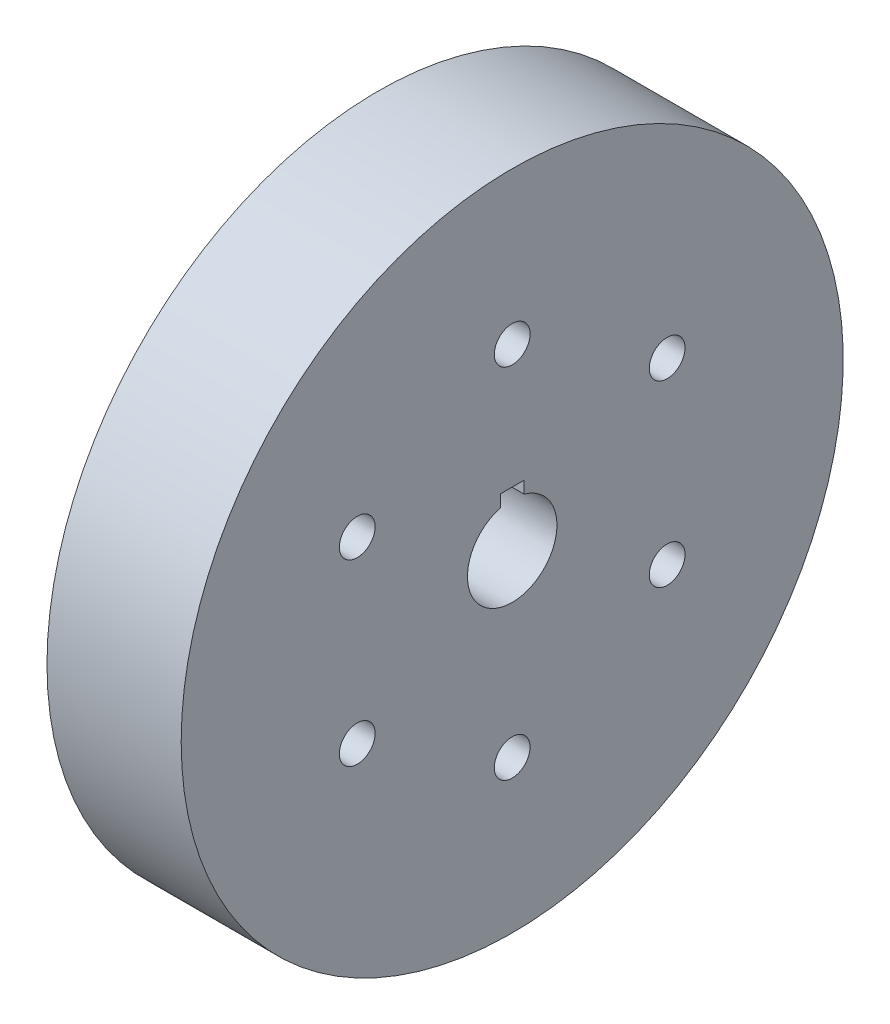
from build123d import *

# Parameters (mm, degrees)
SKETCH5_W          = 8
SKETCH5_H          = 7
CUT_EXTRUDE5_DEPTH = 172.877863613
SKETCH12_R         = 6
CUT_EXTRUDE6_DEPTH = 161.832210704


with BuildPart() as part:
    # Sketch2 → Revolve3 (revolve)
    with BuildSketch(Plane(origin=(0, 0, 0), x_dir=(1, 0, 0), z_dir=(0, 1, 0)), mode=Mode.PRIVATE) as revolve3_sk:
        with BuildLine():
            Line((0, 15), (0, 111))
            Line((0, 111), (-45, 111))
            Line((-45, 111), (-45, 96))
            Line((-45, 96), (-40, 96))
            ThreePointArc((-40, 96), (-36.464466094, 94.535533906), (-35, 91))
            Line((-35, 91), (-35, 35))
            ThreePointArc((-35, 35), (-36.464466094, 31.464466094), (-40, 30))
            Line((-40, 30), (-70, 30))
            Line((-70, 30), (-70, 15))
            Line((-70, 15), (0, 15))
        make_face()
    revolve(revolve3_sk.sketch.rotate(Axis((0, 0, 0), (1, 0, 0)), 180), axis=Axis((0, 0, 0), (1, 0, 0)))

    # Sketch5 → Cut-Extrude5 (cut, through all)
    with BuildSketch(Plane.ZY.offset(70)):
        with Locations((0, 15)):
            Rectangle(SKETCH5_W, SKETCH5_H)
    extrude(amount=-CUT_EXTRUDE5_DEPTH, mode=Mode.SUBTRACT)

    # Sketch12 → Cut-Extrude6 (cut, through all)
    with BuildSketch(Plane.ZY.offset(35)):
        with Locations((51.961524227, 30)):
            Circle(SKETCH12_R)
        with Locations(Location((-51.961524227, 30, 0), (0, 0, 180))):
            Circle(SKETCH12_R)
        with Locations(Location((51.961524227, -30, 0), (0, 0, 180))):
            Circle(SKETCH12_R)
        with Locations((-51.961524227, -30)):
            Circle(SKETCH12_R)
        with Locations((0, 60)):
            Circle(SKETCH12_R)
        with Locations(Location((0, -60, 0), (0, 0, 180))):
            Circle(SKETCH12_R)
    extrude(amount=-CUT_EXTRUDE6_DEPTH, mode=Mode.SUBTRACT)


solid = part.part
